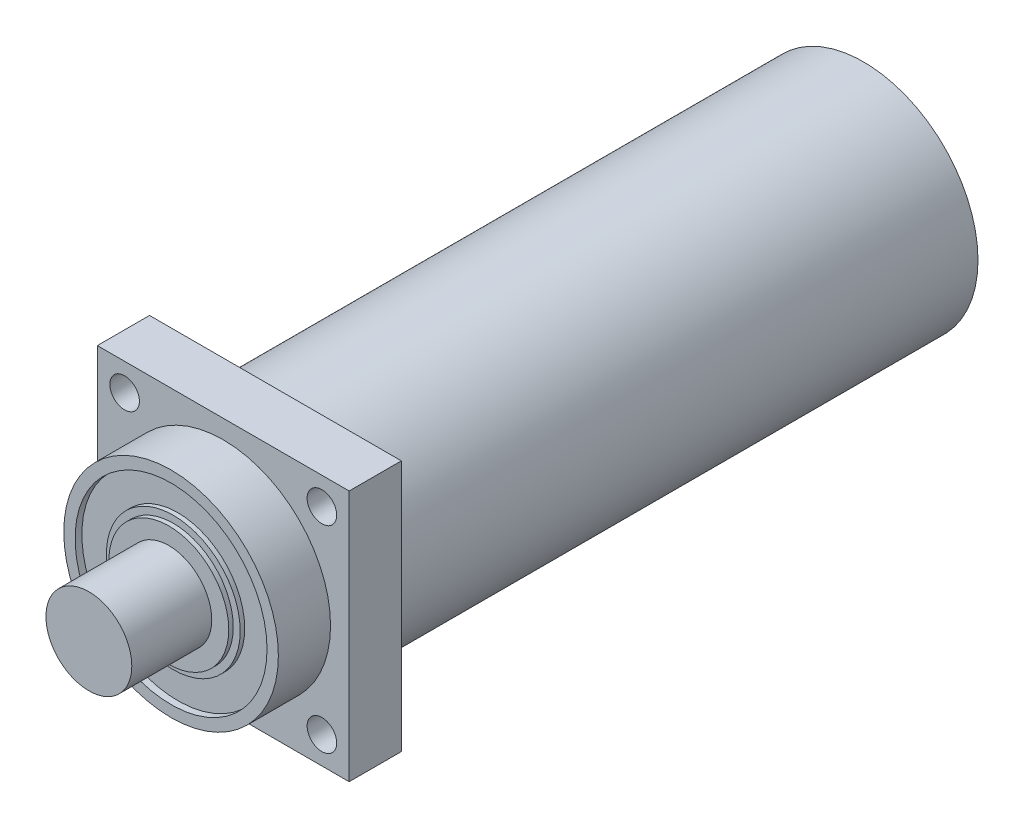
from build123d import *

# Parameters (mm, degrees)
SKETCH2_W           = 27.94
SKETCH2_H           = 27.94
BOSS_EXTRUDE1_DEPTH = 5.79
SKETCH3_R           = 11.905
BOSS_EXTRUDE2_DEPTH = 5.79
SKETCH4_R           = 4.765
BOSS_EXTRUDE3_DEPTH = 9.12
SKETCH5_R           = 12.7
BOSS_EXTRUDE4_DEPTH = 65.25
CUT_EXTRUDE1_START  = -0.75
SKETCH6_R           = 10.648931608
SKETCH6_R_2         = 4.765
CUT_EXTRUDE1_DEPTH  = 0.75
SKETCH7_R           = 7.420951144
BOSS_EXTRUDE5_DEPTH = 0.5
SKETCH8_R           = 6.651278865
BOSS_EXTRUDE6_DEPTH = 0.5
SKETCH9_R           = 1.64
CUT_EXTRUDE2_DEPTH  = 10.5


with BuildPart() as part:
    # Sketch2 → Boss-Extrude1 (new body)
    with BuildSketch(Plane.XY):
        Rectangle(SKETCH2_W, SKETCH2_H)
    extrude(amount=BOSS_EXTRUDE1_DEPTH)

    # Sketch3 → Boss-Extrude2 (add)
    with BuildSketch(Plane.XY.offset(5.79)):
        Circle(SKETCH3_R)
    extrude(amount=BOSS_EXTRUDE2_DEPTH)

    # Sketch4 → Boss-Extrude3 (add)
    with BuildSketch(Plane.XY.offset(11.58)):
        Circle(SKETCH4_R)
    extrude(amount=BOSS_EXTRUDE3_DEPTH)

    # Sketch5 → Boss-Extrude4 (add)
    with BuildSketch(Plane(origin=(0, 0, 0), x_dir=(-1, 0, 0), z_dir=(0, 0, -1))):
        Circle(SKETCH5_R)
    extrude(amount=BOSS_EXTRUDE4_DEPTH)

    # Sketch6 → Cut-Extrude1 (cut)
    with BuildSketch(Plane.XY.offset(11.58).offset(CUT_EXTRUDE1_START)):
        Circle(SKETCH6_R)
        Circle(SKETCH6_R_2, mode=Mode.SUBTRACT)
    extrude(amount=CUT_EXTRUDE1_DEPTH, mode=Mode.SUBTRACT)

    # Sketch7 → Boss-Extrude5 (add)
    with BuildSketch(Plane.XY.offset(10.83)):
        Circle(SKETCH7_R)
    extrude(amount=BOSS_EXTRUDE5_DEPTH)

    # Sketch8 → Boss-Extrude6 (add)
    with BuildSketch(Plane.XY.offset(11.33)):
        Circle(SKETCH8_R)
    extrude(amount=BOSS_EXTRUDE6_DEPTH)

    # Sketch9 → Cut-Extrude2 (cut)
    with BuildSketch(Plane.XY.offset(5.79)):
        with Locations((-10.945, 10.945)):
            Circle(SKETCH9_R)
        with Locations((10.945, 10.945)):
            Circle(SKETCH9_R)
        with Locations((10.945, -10.945)):
            Circle(SKETCH9_R)
        with Locations((-10.945, -10.945)):
            Circle(SKETCH9_R)
    extrude(amount=-CUT_EXTRUDE2_DEPTH, mode=Mode.SUBTRACT)


solid = part.part
